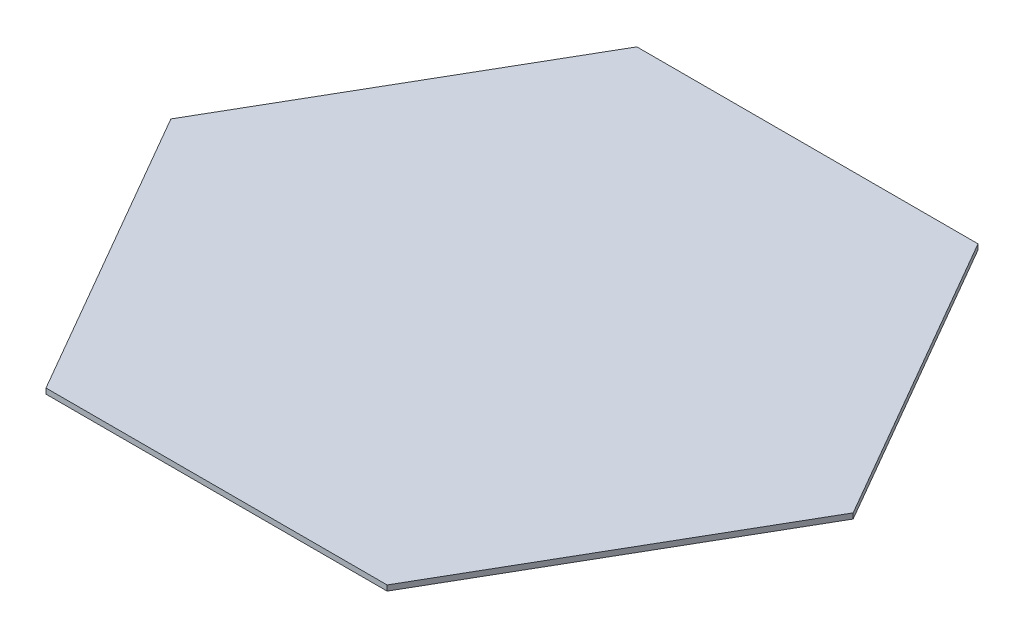
from build123d import *

# Parameters (mm, degrees)
BOSS_EXTRUDE1_DEPTH = 1


with BuildPart() as part:
    # Sketch1 → Boss-Extrude1 (new body)
    with BuildSketch(Plane(origin=(0, 0, 0), x_dir=(1, 0, 0), z_dir=(0, 1, 0))):
        Polygon((-63.5, 0), (-31.75, -54.99261314), (31.75, -54.99261314), (63.5, 0), (31.75, 54.99261314), (-31.75, 54.99261314), align=None)
    extrude(amount=BOSS_EXTRUDE1_DEPTH)


solid = part.part
